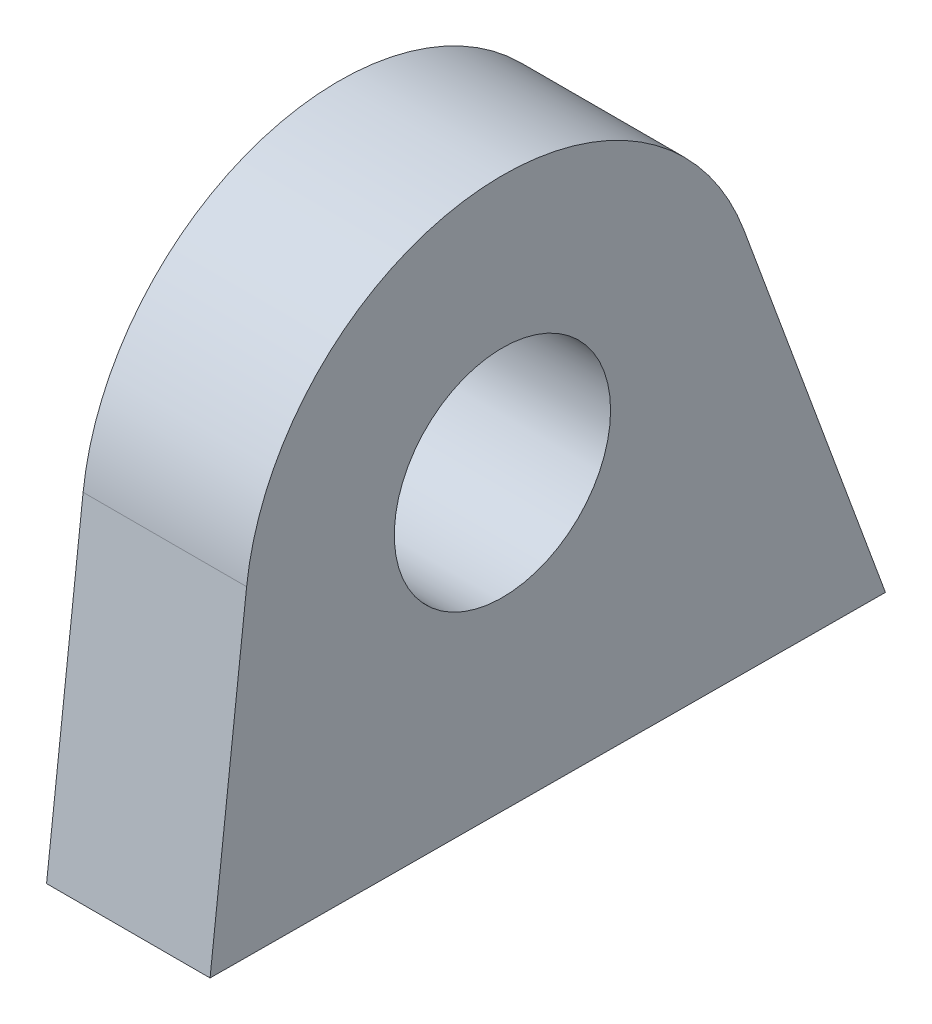
from build123d import *

# Parameters (mm, degrees)
SKETCH1_R           = 4.2
BOSS_EXTRUDE1_DEPTH = 6.35


with BuildPart() as part:
    # Sketch1 → Boss-Extrude1 (new body)
    with BuildSketch(Plane(origin=(71.29240007, 0, 0), x_dir=(0, 0, -1), z_dir=(1, 0, 0))):
        with BuildLine():
            Line((916.713582015, 360.677443288), (922.204212824, 345.758563031))
            Line((922.204212824, 345.758563031), (895.973808013, 345.904541612))
            Line((895.973808013, 345.904541612), (897.39332308, 358.356278755))
            ThreePointArc((897.39332308, 358.356278755), (906.13613116, 367.152203744), (916.713582015, 360.677443288))
        make_face()
        with Locations((907.328968128, 357.223601629)):
            Circle(SKETCH1_R, mode=Mode.SUBTRACT)
    extrude(amount=BOSS_EXTRUDE1_DEPTH)


solid = part.part
